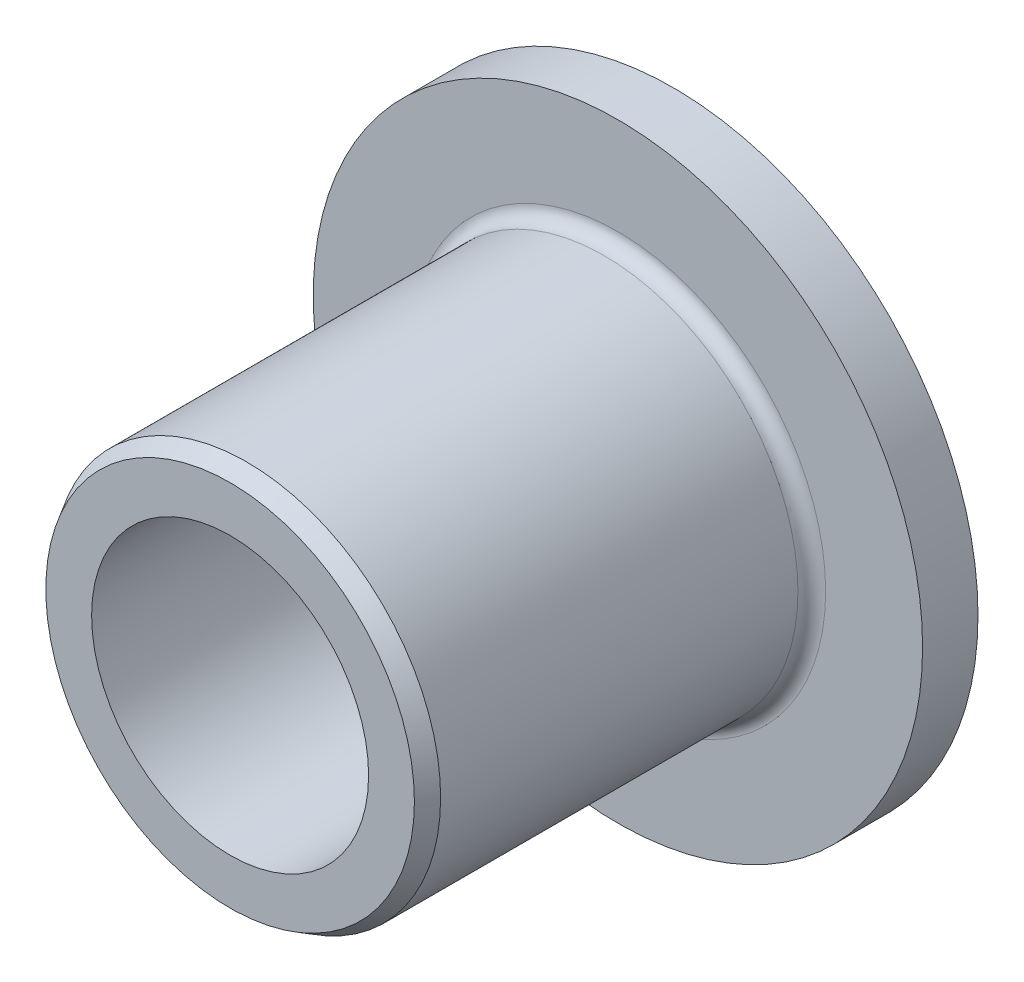
from build123d import *

# Parameters (mm, degrees)
FILLET1_R = 0.25


with BuildPart() as part:
    # Sketch1 → Revolve1 (revolve)
    with BuildSketch(Plane(origin=(0, 0, 0), x_dir=(-1, 0, 0), z_dir=(0, 1, 0))):
        Polygon((-3.5, 1), (-5.5, 1), (-5.5, 0), (-2.5, 0), (-2.5, 8), (-3.326794919, 8), (-3.5, 7.7), align=None)
    revolve(axis=Axis((0, 0, 0), (0, 0, 1)))

    # Fillet1
    fillet1_edges = [part.edges().sort_by_distance(p)[0] for p in [
        (-3.5, 0, 1),
    ]]
    fillet(fillet1_edges, radius=FILLET1_R)


solid = part.part
